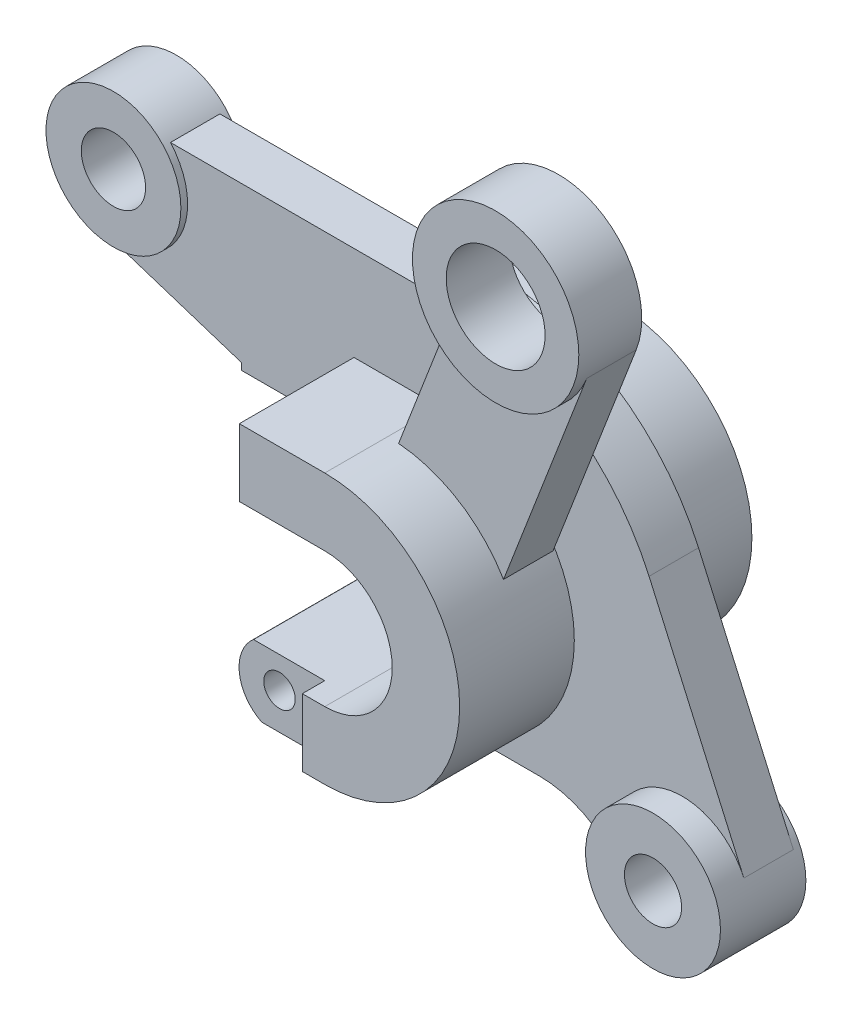
from build123d import *

# Parameters (mm, degrees)
BOSS_EXTRUDE1_DEPTH = 65
BOSS_EXTRUDE2_START = -11
SKETCH1_4_R         = 11
BOSS_EXTRUDE2_DEPTH = 14
BOSS_EXTRUDE3_START = -19
SKETCH1_5_R         = 6.355
BOSS_EXTRUDE3_DEPTH = 19
BOSS_EXTRUDE4_START = -24
SKETCH1_6_R         = 7.1475
BOSS_EXTRUDE4_DEPTH = 14
BOSS_EXTRUDE5_START = -25.5
BOSS_EXTRUDE5_DEPTH = 11
BOSS_EXTRUDE6_START = -25.5
BOSS_EXTRUDE6_DEPTH = 11
BOSS_EXTRUDE8_START = -14
BOSS_EXTRUDE8_DEPTH = 11
BOSS_EXTRUDE9_START = -5
SKETCH1_11_R        = 3.5
BOSS_EXTRUDE9_DEPTH = 55


with BuildPart() as part:
    # Sketch1 → Boss-Extrude1 (new body)
    with BuildSketch(Plane.XY):
        with BuildLine():
            ThreePointArc((2.423237338, 29.901971855), (1.212609656, 29.975482946), (0, 30))
            Line((0, 30), (-19, 30))
            Line((-19, 30), (-19, 15))
            Line((-19, 15), (0, 15))
            ThreePointArc((0, 15), (15, 0), (0, -15))
            Line((0, -15), (-5, -15))
            Line((-5, -15), (-5, -30))
            Line((-5, -30), (0, -30))
            ThreePointArc((0, -30), (26.089312829, -14.810393516), (25.759532638, 15.376816259))
            ThreePointArc((25.759532638, 15.376816259), (15.852828365, 25.469350852), (2.423237338, 29.901971855))
        make_face()
    extrude(amount=-BOSS_EXTRUDE1_DEPTH)



with BuildPart() as body_2:
    # Sketch1<4> → Boss-Extrude2 (new body)
    with BuildSketch(Plane.XY.offset(BOSS_EXTRUDE2_START)):
        with BuildLine():
            ThreePointArc((45.5, 70), (20.437248607, 87.29682902), (13.156184416, 57.728130946))
            ThreePointArc((13.156184416, 57.728130946), (30.286091355, 51.794187642), (44.26053068, 63.342366738))
            ThreePointArc((44.26053068, 63.342366738), (45.187493197, 66.61398594), (45.5, 70))
        make_face()
        with Locations((27, 70)):
            Circle(SKETCH1_4_R, mode=Mode.SUBTRACT)
    extrude(amount=-BOSS_EXTRUDE2_DEPTH)


with BuildPart() as body_3:
    # Sketch1<5> → Boss-Extrude3 (new body)
    with BuildSketch(Plane.XY.offset(BOSS_EXTRUDE3_START)):
        with BuildLine():
            ThreePointArc((69, -33), (68.674928752, -29.894123935), (67.713804516, -26.922865338))
            ThreePointArc((67.713804516, -26.922865338), (47.097213206, -19.682660383), (41.128777406, -40.702702703))
            ThreePointArc((41.128777406, -40.702702703), (57.995726535, -47.458014022), (69, -33))
        make_face()
        with Locations((54, -33)):
            Circle(SKETCH1_5_R, mode=Mode.SUBTRACT)
    extrude(amount=-BOSS_EXTRUDE3_DEPTH)


with BuildPart() as body_4:
    # Sketch1<6> → Boss-Extrude4 (new body)
    with BuildSketch(Plane.XY.offset(BOSS_EXTRUDE4_START)):
        with BuildLine():
            ThreePointArc((-56, 41), (-56.987414616, 46.352331347), (-59.819660113, 51))
            ThreePointArc((-59.819660113, 51), (-83.571760681, 49.182348891), (-75.616979166, 26.728227041))
            ThreePointArc((-75.616979166, 26.728227041), (-62.175451499, 28.870393916), (-56, 41))
        make_face()
        with Locations((-71, 41)):
            Circle(SKETCH1_6_R, mode=Mode.SUBTRACT)
    extrude(amount=-BOSS_EXTRUDE4_DEPTH)


with BuildPart() as part_1:
    add(part.part)

    add(body_4.part)  # Boss-Extrude5 merges body 4
    # Sketch1<7> → Boss-Extrude5 (add)
    with BuildSketch(Plane.XY.offset(BOSS_EXTRUDE5_START)):
        with BuildLine():
            Line((-19, 30), (0, 30))
            ThreePointArc((0, 30), (1.212609656, 29.975482946), (2.423237338, 29.901971855))
            Line((2.423237338, 29.901971855), (10.166256776, 49.976466693))
            ThreePointArc((10.166256776, 49.976466693), (5.10882563, 50.743471508), (0, 51))
            Line((0, 51), (-59.819660113, 51))
            ThreePointArc((-59.819660113, 51), (-56.987414616, 46.352331347), (-56, 41))
            ThreePointArc((-56, 41), (-62.175451499, 28.870393916), (-75.616979166, 26.728227041))
            Line((-75.616979166, 26.728227041), (-44, 16.5))
            Line((-44, 16.5), (-44, 15))
            Line((-44, 15), (-19, 15))
            Line((-19, 15), (-19, 30))
        make_face()
    extrude(amount=-BOSS_EXTRUDE5_DEPTH)


    add(body_3.part)  # Boss-Extrude6 merges body 3
    # Sketch1<8> → Boss-Extrude6 (add)
    with BuildSketch(Plane.XY.offset(BOSS_EXTRUDE6_START)):
        with BuildLine():
            Line((10.166256776, 49.976466693), (2.423237338, 29.901971855))
            ThreePointArc((2.423237338, 29.901971855), (29.975482946, -1.212609656), (0, -30))
            Line((0, -30), (22.250984267, -30))
            ThreePointArc((22.250984267, -30), (33.101317429, -32.861811207), (41.128777406, -40.702702703))
            ThreePointArc((41.128777406, -40.702702703), (47.097213206, -19.682660383), (67.713804516, -26.922865338))
            Line((67.713804516, -26.922865338), (46.626935354, 20.662257852))
            ThreePointArc((46.626935354, 20.662257852), (31.956179028, 39.746730959), (10.166256776, 49.976466693))
        make_face()
    extrude(amount=-BOSS_EXTRUDE6_DEPTH)


    add(body_2.part)  # Boss-Extrude8 merges body 2
    # Sketch1<9> → Boss-Extrude8 (add)
    with BuildSketch(Plane.XY.offset(BOSS_EXTRUDE8_START)):
        with BuildLine():
            ThreePointArc((2.423237338, 29.901971855), (15.852828365, 25.469350852), (25.759532638, 15.376816259))
            Line((25.759532638, 15.376816259), (44.26053068, 63.342366738))
            ThreePointArc((44.26053068, 63.342366738), (30.286091355, 51.794187642), (13.156184416, 57.728130946))
            Line((13.156184416, 57.728130946), (2.423237338, 29.901971855))
        make_face()
    extrude(amount=-BOSS_EXTRUDE8_DEPTH)

    # Sketch1<11> → Boss-Extrude9 (add)
    with BuildSketch(Plane.XY.offset(BOSS_EXTRUDE9_START)):
        with BuildLine():
            Line((-19, -30), (-5, -30))
            Line((-5, -30), (-5, -15))
            Line((-5, -15), (-20.839490527, -15))
            ThreePointArc((-20.839490527, -15), (-24, -23.000372662), (-19, -30))
        make_face()
        with Locations((-15.066920643, -21.904885006)):
            Circle(SKETCH1_11_R, mode=Mode.SUBTRACT)
    extrude(amount=-BOSS_EXTRUDE9_DEPTH)


solid = part_1.part
